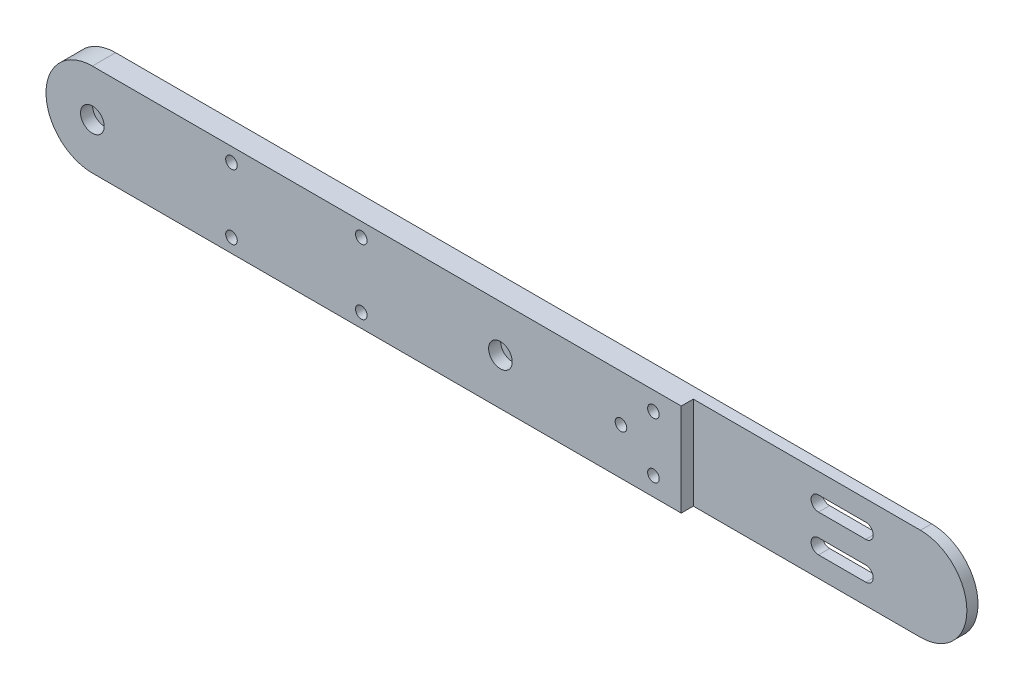
from build123d import *

# Parameters (mm, degrees)
EXTRUDE_1_DEPTH     = 5
SKETCH_1_3_R        = 1.1
CUT_EXTRUDE_2_DEPTH = 187.33571853
SKETCH_1_4_R        = 2.55
CUT_EXTRUDE_3_DEPTH = 2.6
SKETCH_2_R          = 1.25
CUT_EXTRUDE_4_DEPTH = 187.33571853
CUT_EXTRUDE_START   = -5
SKETCH_2_3_R        = 2
CUT_EXTRUDE_5_DEPTH = 2.5
SKETCH_3_W          = 59
SKETCH_3_H          = 2.6
CUT_EXTRUDE_6_DEPTH = 188.138985783
CUT_EXTRUDE_7_DEPTH = 187.33571853
SKETCH_5_W          = 276.925102881
SKETCH_5_H          = 124.694650206
CUT_EXTRUDE_8_DEPTH = 187.871613682


with BuildPart() as part:
    # 草图1 → 凸台-拉伸1 (new body)
    with BuildSketch(Plane.XY):
        with BuildLine():
            Line((0, -10), (176, -10))
            ThreePointArc((176, -10), (186, 0), (176, 10))
            Line((176, 10), (0, 10))
            ThreePointArc((0, 10), (-10, 0), (0, -10))
        make_face()
    extrude(amount=EXTRUDE_1_DEPTH)

    # 草图1<3> → 切除-拉伸2 (cut, through all)
    with BuildSketch(Plane.XY):
        with Locations((88, 0)):
            Circle(SKETCH_1_3_R)
        Circle(SKETCH_1_3_R)
    extrude(amount=CUT_EXTRUDE_2_DEPTH, mode=Mode.SUBTRACT)

    # 草图1<4> → 切除-拉伸3 (cut)
    with BuildSketch(Plane.XY):
        with Locations((88, 0)):
            Circle(SKETCH_1_4_R)
        Circle(SKETCH_1_4_R)
    extrude(amount=CUT_EXTRUDE_3_DEPTH, mode=Mode.SUBTRACT)

    # 草图2 → 切除-拉伸4 (cut, through all)
    with BuildSketch(Plane(origin=(0, 0, 0), x_dir=(-1, 0, 0), z_dir=(0, 0, -1))):
        with Locations((-121, -6)):
            Circle(SKETCH_2_R)
        with Locations((-121, 6)):
            Circle(SKETCH_2_R)
        with Locations((-114, 0)):
            Circle(SKETCH_2_R)
        with Locations((-58, 7)):
            Circle(SKETCH_2_R)
        with Locations((-30, 7)):
            Circle(SKETCH_2_R)
        with Locations((-58, -7)):
            Circle(SKETCH_2_R)
        with Locations((-30, -7)):
            Circle(SKETCH_2_R)
    extrude(amount=-CUT_EXTRUDE_4_DEPTH, mode=Mode.SUBTRACT)

    # 草图2<3> → 切除-拉伸5 (cut)
    with BuildSketch(Plane(origin=(0, 0, 0), x_dir=(-1, 0, 0), z_dir=(0, 0, -1)).offset(CUT_EXTRUDE_START)):
        with Locations(Location((-121, -6, 0), (0, 0, 180))):
            Circle(SKETCH_2_3_R)
        with Locations(Location((-121, 6, 0), (0, 0, 180))):
            Circle(SKETCH_2_3_R)
        with Locations(Location((-114, 0, 0), (0, 0, 180))):
            Circle(SKETCH_2_3_R)
        with Locations(Location((-58, 7, 0), (0, 0, 180))):
            Circle(SKETCH_2_3_R)
        with Locations(Location((-30, 7, 0), (0, 0, 180))):
            Circle(SKETCH_2_3_R)
        with Locations(Location((-58, -7, 0), (0, 0, 180))):
            Circle(SKETCH_2_3_R)
        with Locations(Location((-30, -7, 0), (0, 0, 180))):
            Circle(SKETCH_2_3_R)
    extrude(amount=CUT_EXTRUDE_5_DEPTH, mode=Mode.SUBTRACT)

    # 草图3 → 切除-拉伸6 (cut, through all)
    with BuildSketch(Plane(origin=(0, 10, 0), x_dir=(1, 0, 0), z_dir=(0, 1, 0))):
        with Locations((156.5, -1.3)):
            Rectangle(SKETCH_3_W, SKETCH_3_H)
    extrude(amount=-CUT_EXTRUDE_6_DEPTH, mode=Mode.SUBTRACT)

    # 草图4 → 切除-拉伸7 (cut, through all)
    with BuildSketch(Plane.XY.offset(5)):
        with BuildLine():
            Line((164.2, -2.4), (154, -2.4))
            ThreePointArc((154, -2.4), (152.4, -4), (154, -5.6))
            Line((154, -5.6), (164.2, -5.6))
            ThreePointArc((164.2, -5.6), (165.8, -4), (164.2, -2.4))
        make_face()
        with BuildLine():
            ThreePointArc((154, 5.6), (152.4, 4), (154, 2.4))
            Line((154, 2.4), (164.2, 2.4))
            ThreePointArc((164.2, 2.4), (165.8, 4), (164.2, 5.6))
            Line((164.2, 5.6), (154, 5.6))
        make_face()
    extrude(amount=-CUT_EXTRUDE_7_DEPTH, mode=Mode.SUBTRACT)


with BuildPart() as body_2:
    # 镜向2: mirrored copy
    add(part.part.mirror(Plane.XY.offset(15)))


with BuildPart() as part_1:
    add(part.part)

    # 草图5 → 切除-拉伸8 (cut, through all)
    with BuildSketch(Plane.XY.offset(15)):
        with Locations((84.530041153, -5.708641975)):
            Rectangle(SKETCH_5_W, SKETCH_5_H)
    extrude(amount=-CUT_EXTRUDE_8_DEPTH, mode=Mode.SUBTRACT)


solid = body_2.part
